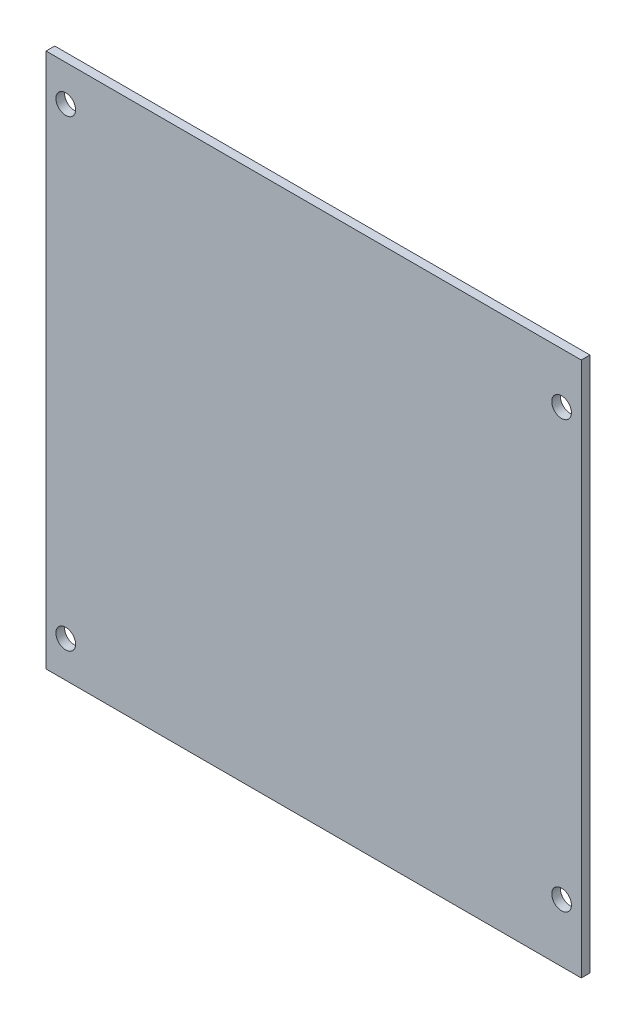
from build123d import *

# Parameters (mm, degrees)
SKETCH1_W            = 92.5
SKETCH1_H            = 92.5
BOSS_EXTRUDE1_DEPTH  = 1.5
M3_CLEARANCE_HOLE1_D = 3.4


with BuildPart() as part:
    # Sketch1 → Boss-Extrude1 (new body)
    with BuildSketch(Plane.XY):
        Rectangle(SKETCH1_W, SKETCH1_H)
    extrude(amount=BOSS_EXTRUDE1_DEPTH)

    # M3 Clearance Hole1 (through all)
    with Locations(Plane(origin=(42.85, -36.2, 1.5), x_dir=(1, 0, 0), z_dir=(0, 0, 1))):
        with Locations((0, 0), (0, 73.7), (-85.7, 76.2), (-85.7, -3.8)):
            Hole(M3_CLEARANCE_HOLE1_D / 2)


solid = part.part
